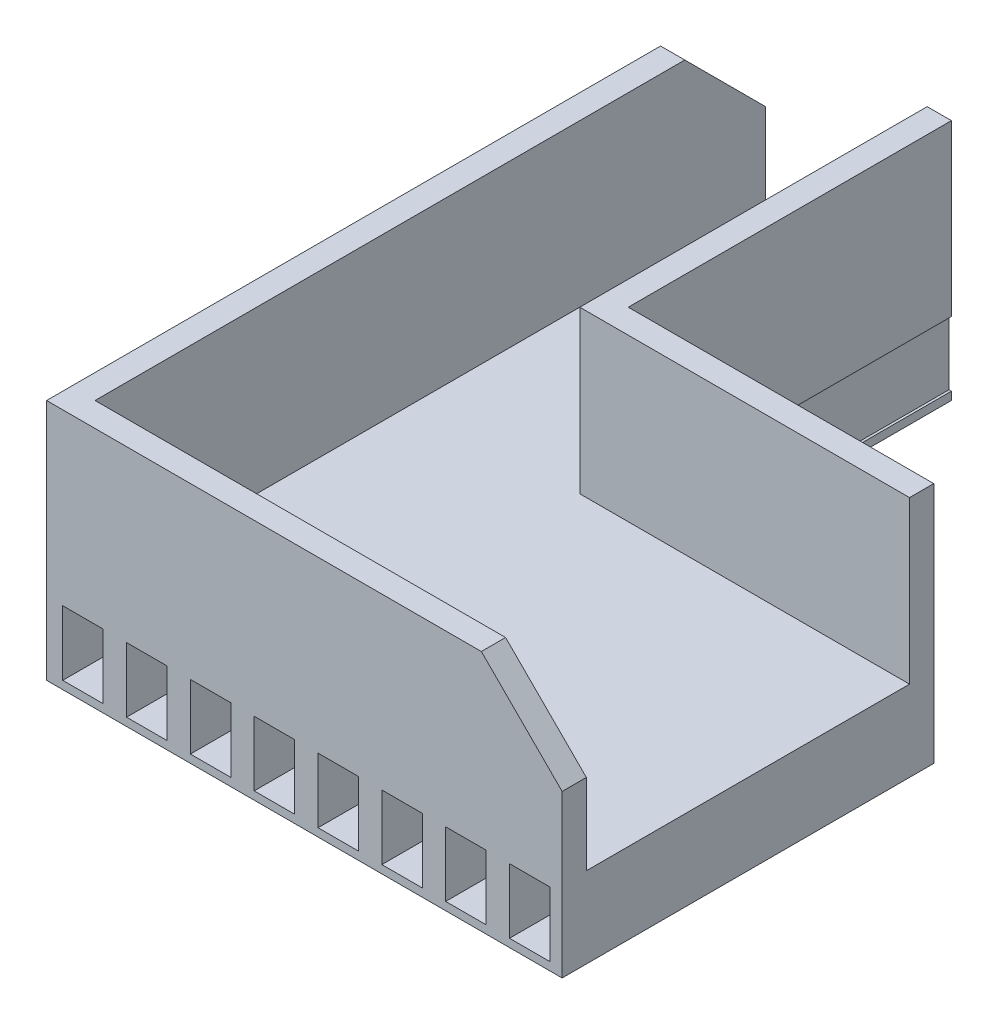
from build123d import *

# Parameters (mm, degrees)
BOSS_EXTRUDE1_DEPTH = 10
EXTRUDE_THIN1_DEPTH = 20
CHAMFER1_SIZE       = 10
SKETCH4_W           = 5
SKETCH4_H           = 8
CUT_EXTRUDE1_DEPTH  = 99


with BuildPart() as part:
    # Sketch1 → Boss-Extrude1 (new body)
    with BuildSketch(Plane(origin=(0, 0, 0), x_dir=(1, 0, 0), z_dir=(0, 1, 0))):
        Polygon((0, 39.088250925), (0, 0), (63.815145827, 0), (63.815145827, 46), (26, 46), (26, 86), (0, 86), align=None)
    extrude(amount=BOSS_EXTRUDE1_DEPTH)

    # Sketch2 → Extrude-Thin1 (add)
    with BuildSketch(Plane(origin=(0, 10, 0), x_dir=(1, 0, 0), z_dir=(0, 1, 0))):
        Polygon((0, 86), (0, 0), (63.815145827, 0), (63.815145827, 3), (3, 3), (3, 86), align=None)
        Polygon((63.815145827, 46), (26, 46), (26, 86), (23, 86), (23, 43), (63.815145827, 43), align=None)
    extrude(amount=EXTRUDE_THIN1_DEPTH)

    # Chamfer1
    chamfer1_edges = [part.edges().sort_by_distance(p)[0] for p in [
        (63.815145827, 30, -1.5),
        (1.5, 30, -86),
    ]]
    chamfer(chamfer1_edges, length=CHAMFER1_SIZE)

    # Sketch4 → Cut-Extrude1 (cut)
    with BuildSketch(Plane.XY):
        with Locations((12.4, 5)):
            Rectangle(SKETCH4_W, SKETCH4_H)
        with Locations((4.5, 5)):
            Rectangle(SKETCH4_W, SKETCH4_H)
        with Locations((20.3, 5)):
            Rectangle(SKETCH4_W, SKETCH4_H)
        with Locations((28.2, 5)):
            Rectangle(SKETCH4_W, SKETCH4_H)
        with Locations((36.1, 5)):
            Rectangle(SKETCH4_W, SKETCH4_H)
        with Locations((44, 5)):
            Rectangle(SKETCH4_W, SKETCH4_H)
        with Locations((51.9, 5)):
            Rectangle(SKETCH4_W, SKETCH4_H)
        with Locations((59.8, 5)):
            Rectangle(SKETCH4_W, SKETCH4_H)
    extrude(amount=-CUT_EXTRUDE1_DEPTH, mode=Mode.SUBTRACT)


solid = part.part
